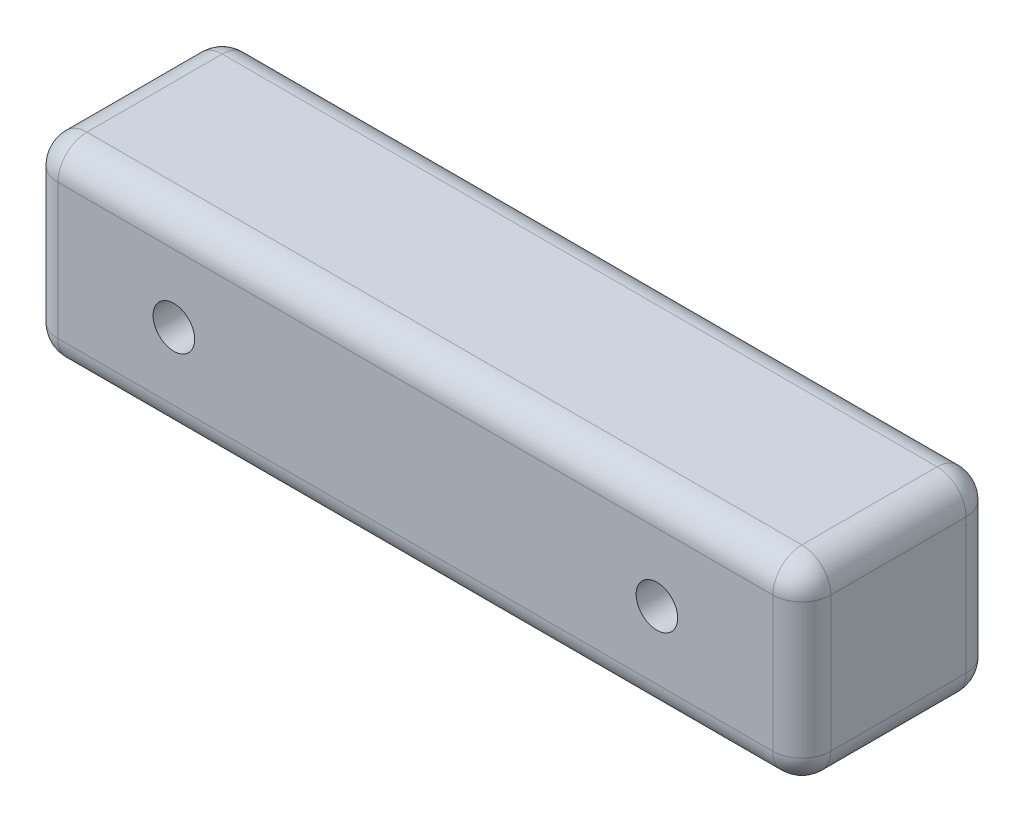
from build123d import *

# Parameters (mm, degrees)
CROQUIS1_W              = 80
CROQUIS1_H              = 20
CROQUIS1_R              = 2.15
SALIENTE_EXTRUIR1_DEPTH = 20
REDONDEO1_R             = 3


with BuildPart() as part:
    # Croquis1 → Saliente-Extruir1 (new body)
    with BuildSketch(Plane.XY):
        Rectangle(CROQUIS1_W, CROQUIS1_H)
        with Locations((25, 0)):
            Circle(CROQUIS1_R, mode=Mode.SUBTRACT)
        with Locations(Location((-25, 0, 0), (0, 0, 180))):
            Circle(CROQUIS1_R, mode=Mode.SUBTRACT)
    extrude(amount=SALIENTE_EXTRUIR1_DEPTH)

    # Redondeo1
    redondeo1_edges = [part.edges().sort_by_distance(p)[0] for p in [
        (40, 0, 20),
        (0, 10, 20),
        (-40, 0, 20),
        (0, 10, 0),
        (40, 0, 0),
        (0, -10, 0),
        (-40, 0, 0),
        (-40, 10, 10),
        (40, 10, 10),
        (40, -10, 10),
        (-40, -10, 10),
        (0, -10, 20),
    ]]
    fillet(redondeo1_edges, radius=REDONDEO1_R)


solid = part.part
